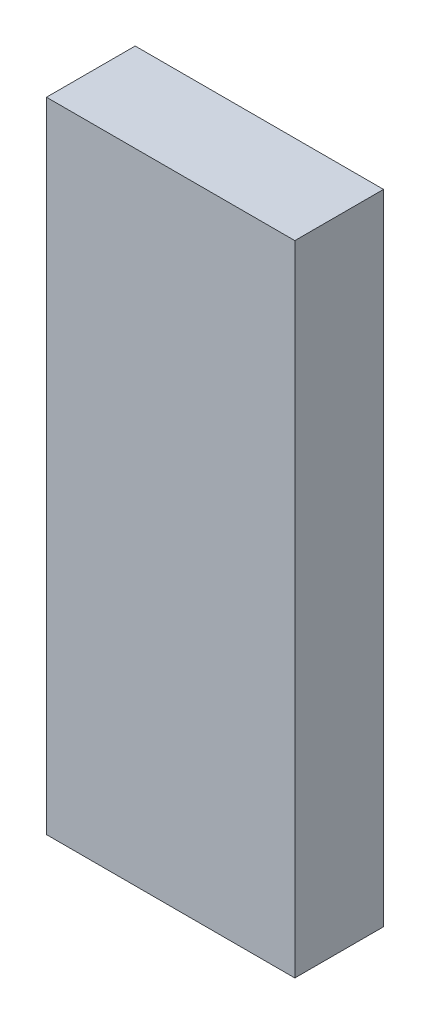
from build123d import *

# Parameters (mm, degrees)
SKETCH1_W           = 70
SKETCH1_H           = 180
BOSS_EXTRUDE1_DEPTH = 25


with BuildPart() as part:
    # Sketch1 → Boss-Extrude1 (new body)
    with BuildSketch(Plane.XY):
        with Locations((3685, 590)):
            Rectangle(SKETCH1_W, SKETCH1_H)
    extrude(amount=BOSS_EXTRUDE1_DEPTH)


solid = part.part
